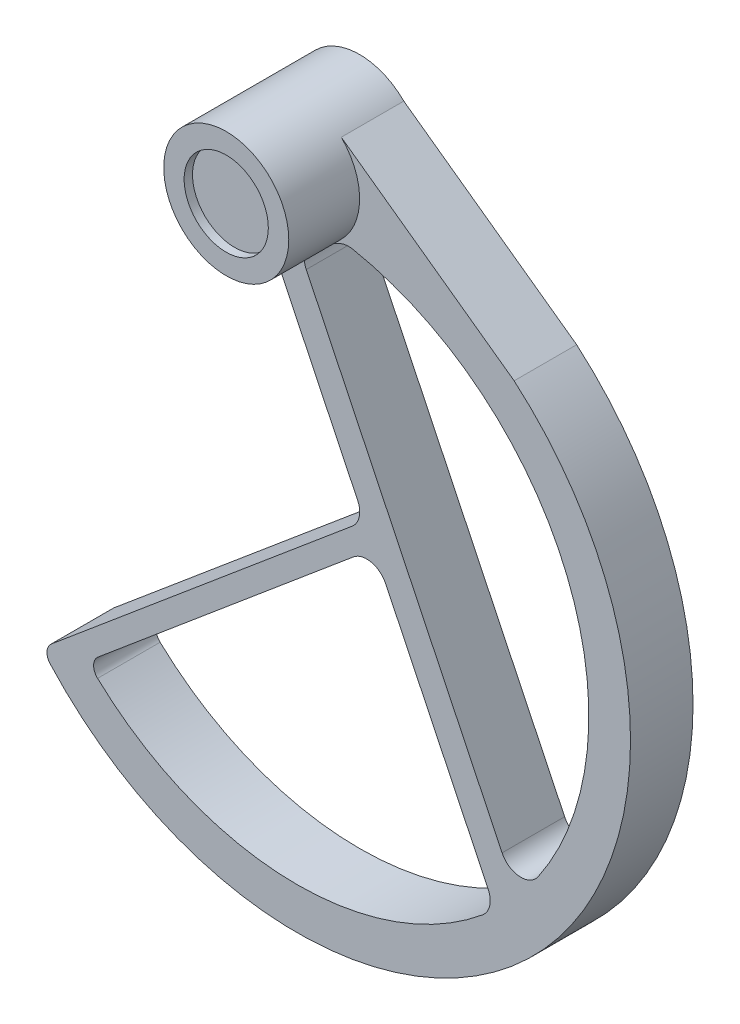
from build123d import *

# Parameters (mm, degrees)
EXTRUDE_1_DEPTH     = 15
CUT_EXTRUDE_START   = -15
CUT_EXTRUDE_1_DEPTH = 15
SKETCH_9_R          = 15
EXTRUDE_2_DEPTH     = 17
SKETCH_10_R         = 10.1
CUT_EXTRUDE_4_DEPTH = 2


with BuildPart() as part:
    # ｽｹｯﾁ4 → ﾎﾞｽ - 押し出し1 (new body)
    with BuildSketch(Plane.XY):
        with BuildLine():
            Line((-53.623111018, -124.995132678), (-58.940636287, -129.45706617))
            ThreePointArc((-58.940636287, -129.45706617), (-60.005384698, -131.552012131), (-59.233530865, -133.771635843))
            ThreePointArc((-59.233530865, -133.771635843), (57.362306223, -135.763481103), (52.076178918, -19.270504783))
            Line((52.076178918, -19.270504783), (10.606601718, 10.606601718))
            ThreePointArc((10.606601718, 10.606601718), (-10.606601718, 10.606601718), (-10.606601718, -10.606601718))
            Line((-10.606601718, -10.606601718), (14.536280154, -62.889638219))
            ThreePointArc((14.536280154, -62.889638219), (14.918089499, -66.109676181), (13.244185189, -68.886809092))
            Line((13.244185189, -68.886809092), (-53.623111018, -124.995132678))
        make_face()
        with BuildLine():
            Line((21.232400696, -76.813798404), (45.844843506, -127.993820346))
            ThreePointArc((45.844843506, -127.993820346), (46.221944165, -131.235480845), (44.518718993, -134.019289696))
            ThreePointArc((44.518718993, -134.019289696), (-2.231208213, -149.964431749), (-47.870174388, -131.072951785))
            ThreePointArc((-47.870174388, -131.072951785), (-48.817477846, -128.802229421), (-47.747678417, -126.586582094))
            Line((-47.747678417, -126.586582094), (13.511229465, -75.151532228))
            ThreePointArc((13.511229465, -75.151532228), (17.77869109, -74.092739753), (21.232400696, -76.813798404))
        make_face(mode=Mode.SUBTRACT)
    extrude(amount=EXTRUDE_1_DEPTH)

    # ｽｹｯﾁ6 → ｶｯﾄ - 押し出し1 (cut)
    with BuildSketch(Plane.XY.offset(15).offset(CUT_EXTRUDE_START)):
        with BuildLine():
            Line((49.189589797, -118.797265215), (2.201751786, -21.089020696))
            ThreePointArc((2.201751786, -21.089020696), (1.989274209, -17.268089629), (4.540836142, -14.416039025))
            Line((4.540836142, -14.416039025), (6.483415605, -13.48185369))
            Line((6.483415605, -13.48185369), (10.219658847, -11.685096486))
            ThreePointArc((10.219658847, -11.685096486), (11.747077013, -11.232198087), (13.339423466, -11.282754846))
            ThreePointArc((13.339423466, -11.282754846), (64.738421392, -53.37413296), (57.826055334, -119.448033215))
            ThreePointArc((57.826055334, -119.448033215), (53.319931874, -121.616182211), (49.189589797, -118.797265215))
        make_face()
    extrude(amount=CUT_EXTRUDE_1_DEPTH, mode=Mode.SUBTRACT)

    # ｽｹｯﾁ9 → ﾎﾞｽ - 押し出し2 (add)
    with BuildSketch(Plane.XY.offset(15)):
        with Locations(Location((0, 0, 0), (0, 0, 225))):
            Circle(SKETCH_9_R)
    extrude(amount=EXTRUDE_2_DEPTH)

    # ｽｹｯﾁ10 → ｶｯﾄ - 押し出し4 (cut)
    with BuildSketch(Plane.XY.offset(32)):
        Circle(SKETCH_10_R)
    extrude(amount=-CUT_EXTRUDE_4_DEPTH, mode=Mode.SUBTRACT)


solid = part.part
